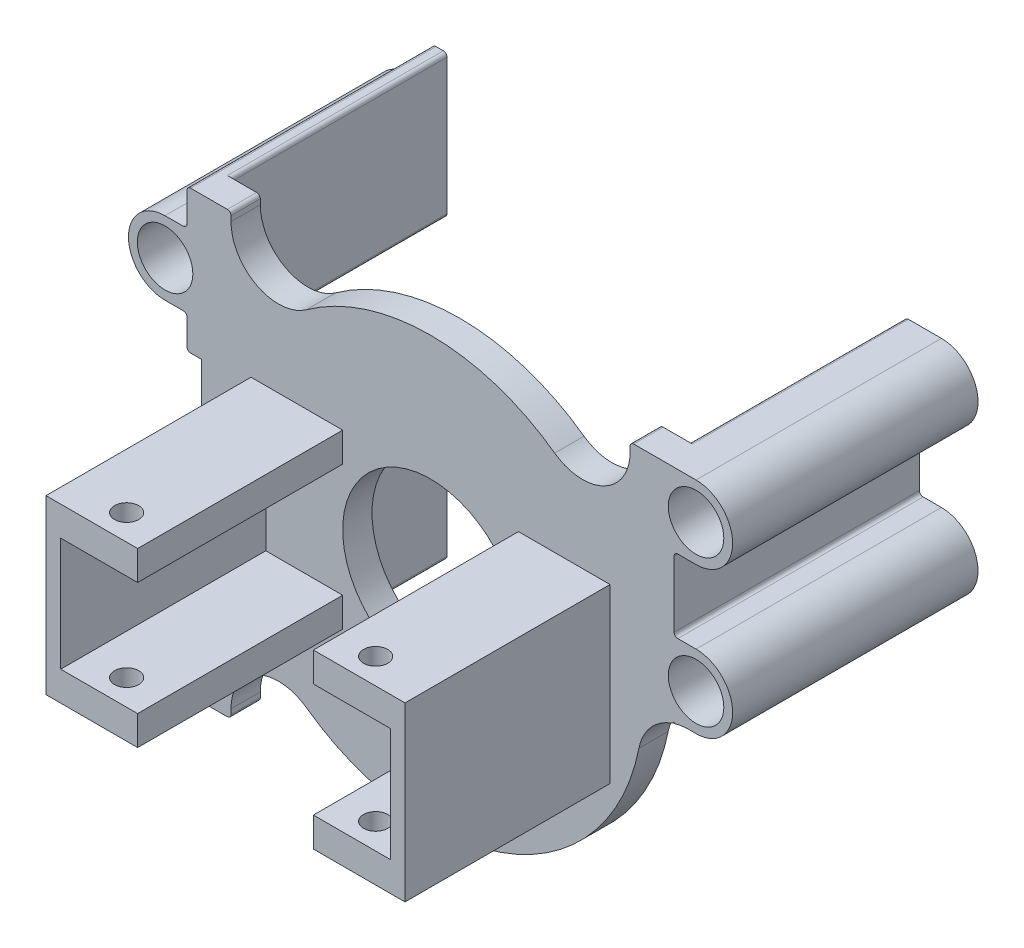
from build123d import *

# Parameters (mm, degrees)
SKETCH1_R           = 1.79
SKETCH1_R_2         = 12
BOSS_EXTRUDE1_DEPTH = 61.5
CUT_EXTRUDE1_DEPTH  = 29.5
CUT_EXTRUDE2_START  = -54.5
SKETCH3_R           = 3.79
CUT_EXTRUDE2_DEPTH  = 54.5
SKETCH4_OUTSIDE_W   = 108.324
SKETCH4_OUTSIDE_H   = 85.824
CUT_EXTRUDE3_DEPTH  = 28
CUT_EXTRUDE4_REACH  = 105.842
SKETCH5_R           = 1.65


with BuildPart() as part:
    # Sketch1 → Boss-Extrude1 (new body)
    with BuildSketch(Plane.XY):
        with BuildLine():
            Line((-5, 56.25), (-2.51, 56.25))
            ThreePointArc((-2.51, 56.25), (-2.156446609, 56.396446609), (-2.01, 56.75))
            Line((-2.01, 56.75), (-2.01, 60.75))
            ThreePointArc((-2.01, 60.75), (-1.863553391, 61.103553391), (-1.51, 61.25))
            Line((-1.51, 61.25), (3.5, 61.25))
            ThreePointArc((3.5, 61.25), (3.853553391, 61.103553391), (4, 60.75))
            Line((4, 60.75), (4, 60.054296555))
            ThreePointArc((4, 60.054296555), (7.537351062, 54.268735971), (14.299295775, 54.780270425))
            ThreePointArc((14.299295775, 54.780270425), (31.25, 60.25), (48.200704225, 54.780270425))
            ThreePointArc((48.200704225, 54.780270425), (54.962648938, 54.268735971), (58.5, 60.054296555))
            Line((58.5, 60.054296555), (58.5, 60.75))
            ThreePointArc((58.5, 60.75), (58.646446609, 61.103553391), (59, 61.25))
            Line((59, 61.25), (67.5, 61.25))
            ThreePointArc((67.5, 61.25), (72.5, 56.25), (67.5, 51.25))
            Line((67.5, 51.25), (65.01, 51.25))
            ThreePointArc((65.01, 51.25), (64.656446609, 51.103553391), (64.51, 50.75))
            Line((64.51, 50.75), (64.51, 41.751676566))
            ThreePointArc((64.51, 41.751676566), (64.656446609, 41.398123176), (65.01, 41.251676566))
            Line((65.01, 41.251676566), (67.5, 41.251676566))
            ThreePointArc((67.5, 41.251676566), (72.5, 36.251676566), (67.5, 31.251676566))
            Line((67.5, 31.251676566), (66.554952113, 31.258700852))
            ThreePointArc((66.554952113, 31.258700852), (62.117679705, 29.664703454), (59.697881988, 25.6181255))
            ThreePointArc((59.697881988, 25.6181255), (41.886466439, 4.271015925), (14.299295775, 7.719729575))
            ThreePointArc((14.299295775, 7.719729575), (7.537351062, 8.231264029), (4, 2.445703445))
            Line((4, 2.445703445), (4, 1.75))
            ThreePointArc((4, 1.75), (3.853553391, 1.396446609), (3.5, 1.25))
            Line((3.5, 1.25), (-1.51, 1.25))
            ThreePointArc((-1.51, 1.25), (-1.863553391, 1.396446609), (-2.01, 1.75))
            Line((-2.01, 1.75), (-2.01, 5.75))
            ThreePointArc((-2.01, 5.75), (-2.156446609, 6.103553391), (-2.51, 6.25))
            Line((-2.51, 6.25), (-5, 6.25))
            ThreePointArc((-5, 6.25), (-10, 11.25), (-5, 16.25))
            Line((-5, 16.25), (-2.51, 16.25))
            ThreePointArc((-2.51, 16.25), (-2.156446609, 16.396446609), (-2.01, 16.75))
            Line((-2.01, 16.75), (-2.01, 20.25))
            ThreePointArc((-2.01, 20.25), (-1.863553391, 20.603553391), (-1.51, 20.75))
            Line((-1.51, 20.75), (0, 20.75))
            Line((0, 20.75), (0, 41.75))
            Line((0, 41.75), (-1.51, 41.75))
            ThreePointArc((-1.51, 41.75), (-1.863553391, 41.896446609), (-2.01, 42.25))
            Line((-2.01, 42.25), (-2.01, 45.75))
            ThreePointArc((-2.01, 45.75), (-2.156446609, 46.103553391), (-2.51, 46.25))
            Line((-2.51, 46.25), (-5, 46.25))
            ThreePointArc((-5, 46.25), (-10, 51.25), (-5, 56.25))
        make_face()
        with Locations((-5, 51.25)):
            Circle(SKETCH1_R, mode=Mode.SUBTRACT)
        with Locations((-5, 11.25)):
            Circle(SKETCH1_R, mode=Mode.SUBTRACT)
        with Locations((67.5, 36.251676566)):
            Circle(SKETCH1_R, mode=Mode.SUBTRACT)
        with Locations((31.25, 31.25)):
            Circle(SKETCH1_R_2, mode=Mode.SUBTRACT)
        with Locations((67.5, 56.25)):
            Circle(SKETCH1_R, mode=Mode.SUBTRACT)
    extrude(amount=BOSS_EXTRUDE1_DEPTH)

    # Sketch2 → Cut-Extrude1 (cut)
    with BuildSketch(Plane.XY):
        with BuildLine():
            Line((0, 1.75), (0, 20.25))
            ThreePointArc((0, 20.25), (-0.146446609, 20.603553391), (-0.5, 20.75))
            Line((-0.5, 20.75), (0, 20.75))
            Line((0, 20.75), (0, 41.75))
            Line((0, 41.75), (-0.5, 41.75))
            ThreePointArc((-0.5, 41.75), (-0.146446609, 41.896446609), (0, 42.25))
            Line((0, 42.25), (0, 60.75))
            ThreePointArc((0, 60.75), (-0.146446609, 61.103553391), (-0.5, 61.25))
            Line((-0.5, 61.25), (0, 61.25))
            Line((0, 61.25), (62.5, 61.25))
            Line((62.5, 61.25), (63, 61.25))
            ThreePointArc((63, 61.25), (62.646446609, 61.103553391), (62.5, 60.75))
            Line((62.5, 60.75), (62.5, 31.758700852))
            ThreePointArc((62.5, 31.758700852), (62.646446609, 31.405147461), (63, 31.258700852))
            Line((63, 31.258700852), (66.554952113, 31.258700852))
            ThreePointArc((66.554952113, 31.258700852), (64.426142906, 30.924061927), (62.5, 29.957736232))
            Line((62.5, 29.957736232), (62.5, 1.25))
            Line((62.5, 1.25), (0, 1.25))
            Line((0, 1.25), (-0.5, 1.25))
            ThreePointArc((-0.5, 1.25), (-0.146446609, 1.396446609), (0, 1.75))
        make_face()
    extrude(amount=CUT_EXTRUDE1_DEPTH, mode=Mode.SUBTRACT)

    # Sketch3 → Cut-Extrude2 (cut)
    with BuildSketch(Plane.XY.offset(61.5).offset(CUT_EXTRUDE2_START)):
        with Locations((67.5, 36.251676566)):
            Circle(SKETCH3_R)
        with Locations((-5, 11.25)):
            Circle(SKETCH3_R)
        with Locations((-5, 51.25)):
            Circle(SKETCH3_R)
        with Locations((67.5, 56.25)):
            Circle(SKETCH3_R)
        with BuildLine():
            Line((64.51, 31.310229119), (64.51, 30.950386606))
            ThreePointArc((64.51, 30.950386606), (64.344469158, 30.897304147), (64.180307475, 30.840127679))
            ThreePointArc((64.180307475, 30.840127679), (64.419361538, 31.023134829), (64.51, 31.310229119))
        make_face()
    extrude(amount=CUT_EXTRUDE2_DEPTH, mode=Mode.SUBTRACT)

    # Sketch4 outside → Cut-Extrude3 (cut)
    with BuildSketch(Plane.XY.offset(61.5)):
        with Locations((31.25, 31.25)):
            Rectangle(SKETCH4_OUTSIDE_W, SKETCH4_OUTSIDE_H)
        Polygon((19.25, 43.02), (6.74, 43.02), (6.74, 19.48), (19.25, 19.48), (19.25, 23.5), (8.75, 23.5), (8.75, 39), (19.25, 39), align=None, mode=Mode.SUBTRACT)
        Polygon((43.25, 19.48), (55.76, 19.48), (55.76, 43.02), (43.25, 43.02), (43.25, 39), (53.75, 39), (53.75, 23.5), (43.25, 23.5), align=None, mode=Mode.SUBTRACT)
    extrude(amount=-CUT_EXTRUDE3_DEPTH, mode=Mode.SUBTRACT)

    # Cut-Extrude4: up to this face of the body (flat: up to its plane)
    cut_extrude4_end = Plane(part.part.faces().sort_by_distance((12.995, 19.48, 47.5))[0])
    # Sketch5 → Cut-Extrude4 (cut, up to the picked face)
    with BuildSketch(Plane(origin=(0, 43.02, 0), x_dir=(1, 0, 0), z_dir=(0, 1, 0)), mode=Mode.PRIVATE) as cut_extrude4_sk1:
        with Locations(Location((48.25, -58, 0), (0, 0, 270))):
            Circle(SKETCH5_R)
    cut_extrude4_tool1 = split(extrude(cut_extrude4_sk1.sketch, amount=-CUT_EXTRUDE4_REACH, mode=Mode.PRIVATE), bisect_by=cut_extrude4_end, keep=Keep.BOTH, mode=Mode.PRIVATE)
    # Sketch5 → Cut-Extrude4 (cut, up to the picked face)
    with BuildSketch(Plane(origin=(0, 43.02, 0), x_dir=(1, 0, 0), z_dir=(0, 1, 0)), mode=Mode.PRIVATE) as cut_extrude4_sk2:
        with Locations(Location((14.25, -58, 0), (0, 0, 270))):
            Circle(SKETCH5_R)
    cut_extrude4_tool2 = split(extrude(cut_extrude4_sk2.sketch, amount=-CUT_EXTRUDE4_REACH, mode=Mode.PRIVATE), bisect_by=cut_extrude4_end, keep=Keep.BOTH, mode=Mode.PRIVATE)
    add(cut_extrude4_tool1.solids().sort_by(Axis((48.25, 43.02, 58), (0, -1, 0)))[0], mode=Mode.SUBTRACT)
    add(cut_extrude4_tool2.solids().sort_by(Axis((14.25, 43.02, 58), (0, -1, 0)))[0], mode=Mode.SUBTRACT)


solid = part.part
